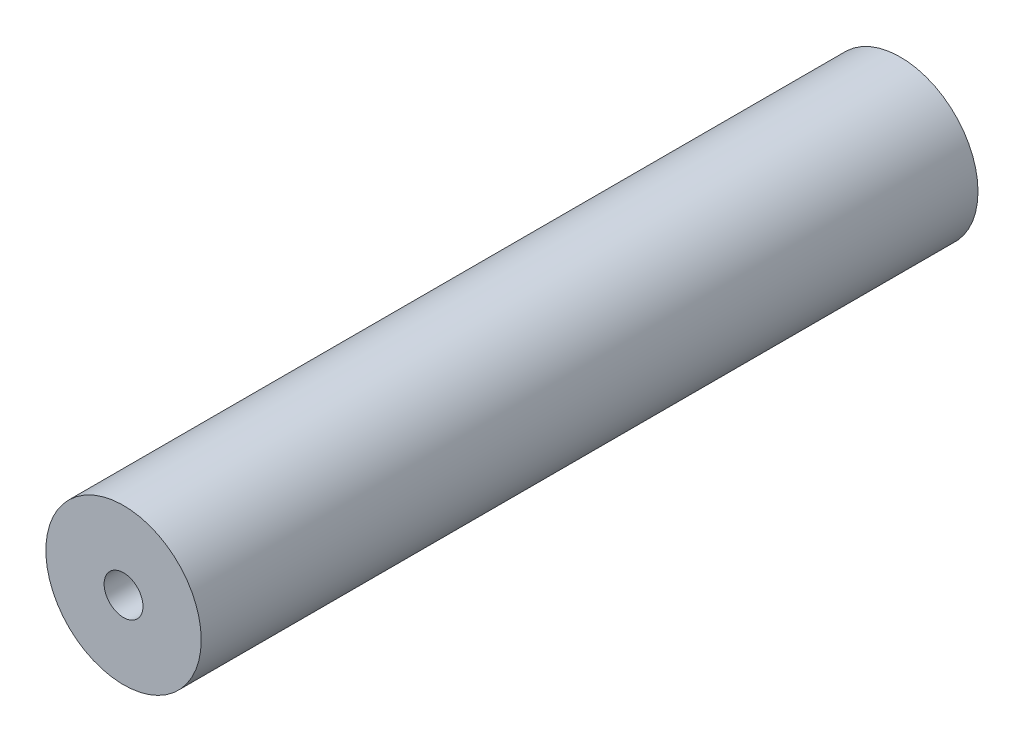
from build123d import *

# Parameters (mm, degrees)
SKETCH1_R           = 40
BOSS_EXTRUDE1_DEPTH = 200
SKETCH2_R           = 10
CUT_EXTRUDE1_DEPTH  = 120
CUT_EXTRUDE2_START  = -120
SKETCH3_R           = 10
CUT_EXTRUDE2_DEPTH  = 120


with BuildPart() as part:
    # Sketch1 → Boss-Extrude1 (new, symmetric)
    with BuildSketch(Plane.XY):
        Circle(SKETCH1_R)
    extrude(amount=BOSS_EXTRUDE1_DEPTH, both=True)

    # Sketch2 → Cut-Extrude1 (cut)
    with BuildSketch(Plane.XY.offset(200)):
        Circle(SKETCH2_R)
    extrude(amount=-CUT_EXTRUDE1_DEPTH, mode=Mode.SUBTRACT)

    # Sketch3 → Cut-Extrude2 (cut)
    with BuildSketch(Plane(origin=(0, 0, -200), x_dir=(-1, 0, 0), z_dir=(0, 0, -1)).offset(CUT_EXTRUDE2_START)):
        with Locations(Location((0, 0, 0), (0, 0, 180))):
            Circle(SKETCH3_R)
    extrude(amount=CUT_EXTRUDE2_DEPTH, mode=Mode.SUBTRACT)


solid = part.part
